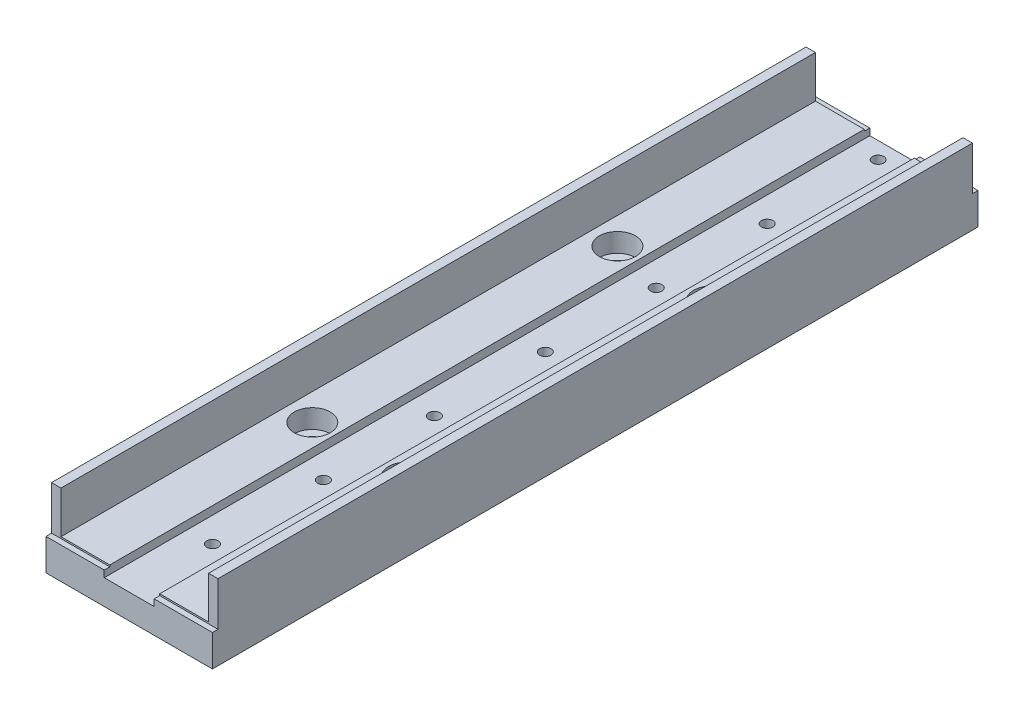
from build123d import *

# Parameters (mm, degrees)
BODY_DEPTH             = 138
SKETCH_2_W             = 30
SKETCH_2_H             = 1
CUT1_DEPTH             = 7.9
FIXTURE_M3_D           = 3.4
FIXTURE_M3_DEPTH       = 6
FIXTURE_M3_CBORE_D     = 6.5
FIXTURE_M3_CBORE_DEPTH = 3.4
FIXTURE_M3_TIP         = 1.021463052
PATTERN_LINEAR_1_COUNT = 7
PATTERN_LINEAR_1_PITCH = 20


with BuildPart() as part:
    # Эскиз1 → Body (new body)
    with BuildSketch(Plane.XY):
        Polygon((-15, -3), (15, -3), (15, 3), (15, 10.6), (13.3, 10.6), (13.3, 3), (4.5, 3), (4.5, 1.5), (-4.5, 1.5), (-4.5, 3), (-13.3, 3), (-13.3, 10.6), (-15, 10.6), (-15, 3), align=None)
    extrude(amount=BODY_DEPTH)

    # Эскиз2 → Cut1 (cut)
    with BuildSketch(Plane(origin=(0, 10.6, 0), x_dir=(1, 0, 0), z_dir=(0, 1, 0))):
        with Locations((0, -137.5)):
            Rectangle(SKETCH_2_W, SKETCH_2_H)
        with Locations((0, -0.5)):
            Rectangle(SKETCH_2_W, SKETCH_2_H)
    extrude(amount=-CUT1_DEPTH, mode=Mode.SUBTRACT)

    # Fixture M3
    with Locations(Plane(origin=(-8.5, 3, 96.5), x_dir=(1, 0, 0), z_dir=(0, 1, 0))):
        with Locations((0, 0), (17, 0), (17, 55), (0, 55)):
            CounterBoreHole(FIXTURE_M3_D / 2, FIXTURE_M3_CBORE_D / 2, FIXTURE_M3_CBORE_DEPTH, depth=FIXTURE_M3_DEPTH)
            with Locations((0, 0, -(FIXTURE_M3_DEPTH + FIXTURE_M3_TIP / 2))):  # 118° drill point
                Cone(0, FIXTURE_M3_D / 2, FIXTURE_M3_TIP, mode=Mode.SUBTRACT)

    # Эскиз7 → Fixture M2 (revolve, cut)
    with BuildSketch(Plane(origin=(0, 1.5, 123), x_dir=(0, 0, 1), z_dir=(1, 0, 0))):
        Polygon((0, 0), (0, 5.115882135), (1.025, 4.5), (1.025, 0), align=None)
    fixture_m2 = revolve(axis=Axis((0, 7.85, 123), (0, -1, 0)), mode=Mode.SUBTRACT)

    # Линейный массив1: Fixture M2 ×7
    with Locations(*[(0, 0, -i * PATTERN_LINEAR_1_PITCH) for i in range(1, PATTERN_LINEAR_1_COUNT)]):
        add(fixture_m2, mode=Mode.SUBTRACT)


solid = part.part
